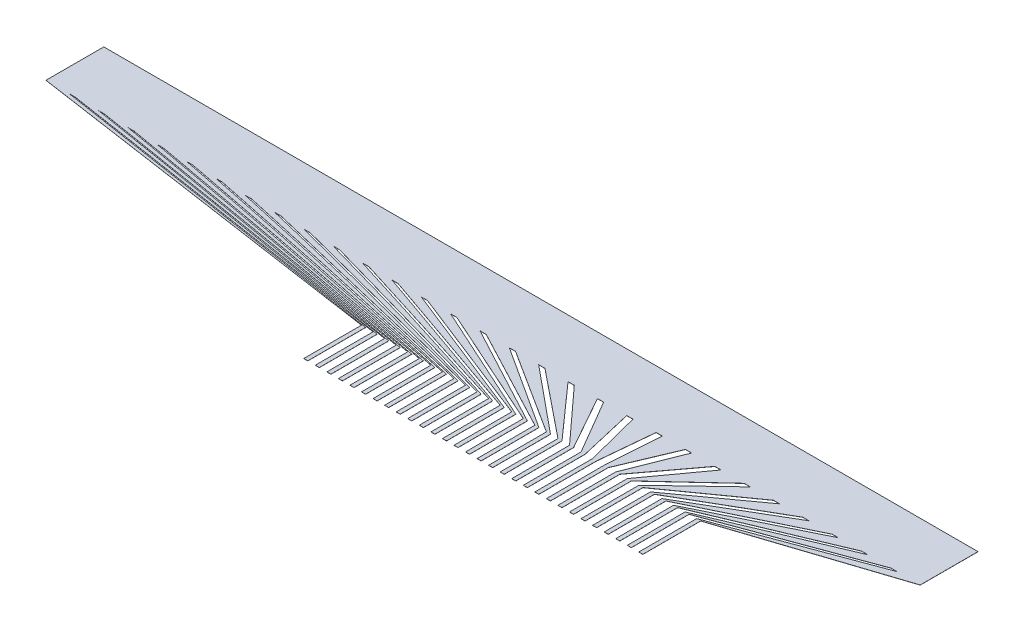
from build123d import *

# Parameters (mm, degrees)
EXTRUDE_1_DEPTH     = 0.01
EXTRUDE_1_2_DEPTH   = 0.01
EXTRUDE_1_3_DEPTH   = 0.01
EXTRUDE_1_4_DEPTH   = 0.01
EXTRUDE_1_5_DEPTH   = 0.01
EXTRUDE_1_6_DEPTH   = 0.01
EXTRUDE_1_7_DEPTH   = 0.01
EXTRUDE_1_8_DEPTH   = 0.01
EXTRUDE_1_9_DEPTH   = 0.01
EXTRUDE_1_10_DEPTH  = 0.01
EXTRUDE_1_11_DEPTH  = 0.01
EXTRUDE_1_12_DEPTH  = 0.01
EXTRUDE_1_13_DEPTH  = 0.01
EXTRUDE_1_14_DEPTH  = 0.01
EXTRUDE_1_15_DEPTH  = 0.01
EXTRUDE_1_16_DEPTH  = 0.01
EXTRUDE_1_17_DEPTH  = 0.01
EXTRUDE_1_18_DEPTH  = 0.01
EXTRUDE_1_19_DEPTH  = 0.01
EXTRUDE_1_20_DEPTH  = 0.01
EXTRUDE_1_21_DEPTH  = 0.01
EXTRUDE_1_22_DEPTH  = 0.01
EXTRUDE_1_23_DEPTH  = 0.01
EXTRUDE_1_24_DEPTH  = 0.01
EXTRUDE_1_25_DEPTH  = 0.01
EXTRUDE_1_26_DEPTH  = 0.01
EXTRUDE_1_27_DEPTH  = 0.01
EXTRUDE_1_28_DEPTH  = 0.01
EXTRUDE_1_29_DEPTH  = 0.01
EXTRUDE_1_30_DEPTH  = 0.01
SKETCH_2_W          = 75.66
SKETCH_2_H          = 5
EXTRUDE_2_DEPTH     = 0.01
SKETCH_3_W          = 29.347621289
SKETCH_3_H          = 1
CUT_EXTRUDE_1_DEPTH = 0.01


with BuildPart() as part:
    # 草图1 → 凸台-拉伸1 (new body)
    with BuildSketch(Plane(origin=(0, 0, 0), x_dir=(1, 0, 0), z_dir=(0, 1, 0))):
        Polygon((76.2, 0), (76.2, -5), (61.89758937, -9.7), (61.89758937, -15.7), (61.549968081, -15.7), (61.549968081, -9.7), (74.2, -5), (74.2, 0), align=None)
    extrude(amount=EXTRUDE_1_DEPTH)



with BuildPart() as body_2:
    # 草图1 → Extrude 1 2 (new body)
    with BuildSketch(Plane(origin=(0, 0, 0), x_dir=(1, 0, 0), z_dir=(0, 1, 0))):
        Polygon((71.66, 0), (73.66, 0), (73.66, -5), (60.89758937, -9.7), (60.89758937, -15.7), (60.549968081, -15.7), (60.549968081, -9.7), (71.66, -5), align=None)
    extrude(amount=EXTRUDE_1_2_DEPTH)


with BuildPart() as body_3:
    # 草图1 → Extrude 1 3 (new body)
    with BuildSketch(Plane(origin=(0, 0, 0), x_dir=(1, 0, 0), z_dir=(0, 1, 0))):
        Polygon((69.12, 0), (71.12, 0), (71.12, -5), (59.89758937, -9.7), (59.89758937, -15.7), (59.549968081, -15.7), (59.549968081, -9.7), (69.12, -5), align=None)
    extrude(amount=EXTRUDE_1_3_DEPTH)


with BuildPart() as body_4:
    # 草图1 → Extrude 1 4 (new body)
    with BuildSketch(Plane(origin=(0, 0, 0), x_dir=(1, 0, 0), z_dir=(0, 1, 0))):
        Polygon((66.58, 0), (68.58, 0), (68.58, -5), (58.89758937, -9.7), (58.89758937, -15.7), (58.549968081, -15.7), (58.549968081, -9.7), (66.58, -5), align=None)
    extrude(amount=EXTRUDE_1_4_DEPTH)


with BuildPart() as body_5:
    # 草图1 → Extrude 1 5 (new body)
    with BuildSketch(Plane(origin=(0, 0, 0), x_dir=(1, 0, 0), z_dir=(0, 1, 0))):
        Polygon((64.04, 0), (66.04, 0), (66.04, -5), (57.89758937, -9.7), (57.89758937, -15.7), (57.549968081, -15.7), (57.549968081, -9.7), (64.04, -5), align=None)
    extrude(amount=EXTRUDE_1_5_DEPTH)


with BuildPart() as body_6:
    # 草图1 → Extrude 1 6 (new body)
    with BuildSketch(Plane(origin=(0, 0, 0), x_dir=(1, 0, 0), z_dir=(0, 1, 0))):
        Polygon((61.5, 0), (63.5, 0), (63.5, -5), (56.89758937, -9.7), (56.89758937, -15.7), (56.549968081, -15.7), (56.549968081, -9.7), (61.5, -5), align=None)
    extrude(amount=EXTRUDE_1_6_DEPTH)


with BuildPart() as body_7:
    # 草图1 → Extrude 1 7 (new body)
    with BuildSketch(Plane(origin=(0, 0, 0), x_dir=(1, 0, 0), z_dir=(0, 1, 0))):
        Polygon((58.96, 0), (60.96, 0), (60.96, -5), (55.89758937, -9.7), (55.89758937, -15.7), (55.549968081, -15.7), (55.549968081, -9.7), (58.96, -5), align=None)
    extrude(amount=EXTRUDE_1_7_DEPTH)


with BuildPart() as body_8:
    # 草图1 → Extrude 1 8 (new body)
    with BuildSketch(Plane(origin=(0, 0, 0), x_dir=(1, 0, 0), z_dir=(0, 1, 0))):
        Polygon((56.42, 0), (58.42, 0), (58.42, -5), (54.89758937, -9.7), (54.89758937, -15.7), (54.549968081, -15.7), (54.549968081, -9.7), (56.42, -5), align=None)
    extrude(amount=EXTRUDE_1_8_DEPTH)


with BuildPart() as body_9:
    # 草图1 → Extrude 1 9 (new body)
    with BuildSketch(Plane(origin=(0, 0, 0), x_dir=(1, 0, 0), z_dir=(0, 1, 0))):
        Polygon((53.88, 0), (55.88, 0), (55.88, -5), (53.89758937, -9.7), (53.89758937, -15.7), (53.549968081, -15.7), (53.549968081, -9.7), (53.88, -5), align=None)
    extrude(amount=EXTRUDE_1_9_DEPTH)


with BuildPart() as body_10:
    # 草图1 → Extrude 1 10 (new body)
    with BuildSketch(Plane(origin=(0, 0, 0), x_dir=(1, 0, 0), z_dir=(0, 1, 0))):
        Polygon((51.34, 0), (53.34, 0), (53.34, -5), (52.89758937, -9.7), (52.89758937, -15.7), (52.549968081, -15.7), (52.549968081, -9.7), (51.34, -5), align=None)
    extrude(amount=EXTRUDE_1_10_DEPTH)


with BuildPart() as body_11:
    # 草图1 → Extrude 1 11 (new body)
    with BuildSketch(Plane(origin=(0, 0, 0), x_dir=(1, 0, 0), z_dir=(0, 1, 0))):
        Polygon((48.8, 0), (50.8, 0), (50.8, -5), (51.89758937, -9.7), (51.89758937, -15.7), (51.549968081, -15.7), (51.549968081, -9.7), (48.8, -5), align=None)
    extrude(amount=EXTRUDE_1_11_DEPTH)


with BuildPart() as body_12:
    # 草图1 → Extrude 1 12 (new body)
    with BuildSketch(Plane(origin=(0, 0, 0), x_dir=(1, 0, 0), z_dir=(0, 1, 0))):
        Polygon((46.26, 0), (48.26, 0), (48.26, -5), (50.89758937, -9.7), (50.89758937, -15.7), (50.549968081, -15.7), (50.549968081, -9.7), (46.26, -5), align=None)
    extrude(amount=EXTRUDE_1_12_DEPTH)


with BuildPart() as body_13:
    # 草图1 → Extrude 1 13 (new body)
    with BuildSketch(Plane(origin=(0, 0, 0), x_dir=(1, 0, 0), z_dir=(0, 1, 0))):
        Polygon((43.72, 0), (45.72, 0), (45.72, -5), (49.89758937, -9.7), (49.89758937, -15.7), (49.549968081, -15.7), (49.549968081, -9.7), (43.72, -5), align=None)
    extrude(amount=EXTRUDE_1_13_DEPTH)


with BuildPart() as body_14:
    # 草图1 → Extrude 1 14 (new body)
    with BuildSketch(Plane(origin=(0, 0, 0), x_dir=(1, 0, 0), z_dir=(0, 1, 0))):
        Polygon((41.18, 0), (43.18, 0), (43.18, -5), (48.89758937, -9.7), (48.89758937, -15.7), (48.549968081, -15.7), (48.549968081, -9.7), (41.18, -5), align=None)
    extrude(amount=EXTRUDE_1_14_DEPTH)


with BuildPart() as body_15:
    # 草图1 → Extrude 1 15 (new body)
    with BuildSketch(Plane(origin=(0, 0, 0), x_dir=(1, 0, 0), z_dir=(0, 1, 0))):
        Polygon((38.64, 0), (40.64, 0), (40.64, -5), (47.89758937, -9.7), (47.89758937, -15.7), (47.549968081, -15.7), (47.549968081, -9.7), (38.64, -5), align=None)
    extrude(amount=EXTRUDE_1_15_DEPTH)


with BuildPart() as body_16:
    # 草图1 → Extrude 1 16 (new body)
    with BuildSketch(Plane(origin=(0, 0, 0), x_dir=(1, 0, 0), z_dir=(0, 1, 0))):
        Polygon((36.1, 0), (38.1, 0), (38.1, -5), (46.89758937, -9.7), (46.89758937, -15.7), (46.549968081, -15.7), (46.549968081, -9.7), (36.1, -5), align=None)
    extrude(amount=EXTRUDE_1_16_DEPTH)


with BuildPart() as body_17:
    # 草图1 → Extrude 1 17 (new body)
    with BuildSketch(Plane(origin=(0, 0, 0), x_dir=(1, 0, 0), z_dir=(0, 1, 0))):
        Polygon((33.56, 0), (35.56, 0), (35.56, -5), (45.89758937, -9.7), (45.89758937, -15.7), (45.549968081, -15.7), (45.549968081, -9.7), (33.56, -5), align=None)
    extrude(amount=EXTRUDE_1_17_DEPTH)


with BuildPart() as body_18:
    # 草图1 → Extrude 1 18 (new body)
    with BuildSketch(Plane(origin=(0, 0, 0), x_dir=(1, 0, 0), z_dir=(0, 1, 0))):
        Polygon((31.02, 0), (33.02, 0), (33.02, -5), (44.89758937, -9.7), (44.89758937, -15.7), (44.549968081, -15.7), (44.549968081, -9.7), (31.02, -5), align=None)
    extrude(amount=EXTRUDE_1_18_DEPTH)


with BuildPart() as body_19:
    # 草图1 → Extrude 1 19 (new body)
    with BuildSketch(Plane(origin=(0, 0, 0), x_dir=(1, 0, 0), z_dir=(0, 1, 0))):
        Polygon((28.48, 0), (30.48, 0), (30.48, -5), (43.89758937, -9.7), (43.89758937, -15.7), (43.549968081, -15.7), (43.549968081, -9.7), (28.48, -5), align=None)
    extrude(amount=EXTRUDE_1_19_DEPTH)


with BuildPart() as body_20:
    # 草图1 → Extrude 1 20 (new body)
    with BuildSketch(Plane(origin=(0, 0, 0), x_dir=(1, 0, 0), z_dir=(0, 1, 0))):
        Polygon((25.94, 0), (27.94, 0), (27.94, -5), (42.89758937, -9.7), (42.89758937, -15.7), (42.549968081, -15.7), (42.549968081, -9.7), (25.94, -5), align=None)
    extrude(amount=EXTRUDE_1_20_DEPTH)


with BuildPart() as body_21:
    # 草图1 → Extrude 1 21 (new body)
    with BuildSketch(Plane(origin=(0, 0, 0), x_dir=(1, 0, 0), z_dir=(0, 1, 0))):
        Polygon((23.4, 0), (25.4, 0), (25.4, -5), (41.89758937, -9.7), (41.89758937, -15.7), (41.549968081, -15.7), (41.549968081, -9.7), (23.4, -5), align=None)
    extrude(amount=EXTRUDE_1_21_DEPTH)


with BuildPart() as body_22:
    # 草图1 → Extrude 1 22 (new body)
    with BuildSketch(Plane(origin=(0, 0, 0), x_dir=(1, 0, 0), z_dir=(0, 1, 0))):
        Polygon((20.86, 0), (22.86, 0), (22.86, -5), (40.89758937, -9.7), (40.89758937, -15.7), (40.549968081, -15.7), (40.549968081, -9.7), (20.86, -5), align=None)
    extrude(amount=EXTRUDE_1_22_DEPTH)


with BuildPart() as body_23:
    # 草图1 → Extrude 1 23 (new body)
    with BuildSketch(Plane(origin=(0, 0, 0), x_dir=(1, 0, 0), z_dir=(0, 1, 0))):
        Polygon((18.32, 0), (20.32, 0), (20.32, -5), (39.89758937, -9.7), (39.89758937, -15.7), (39.549968081, -15.7), (39.549968081, -9.7), (18.32, -5), align=None)
    extrude(amount=EXTRUDE_1_23_DEPTH)


with BuildPart() as body_24:
    # 草图1 → Extrude 1 24 (new body)
    with BuildSketch(Plane(origin=(0, 0, 0), x_dir=(1, 0, 0), z_dir=(0, 1, 0))):
        Polygon((15.78, 0), (17.78, 0), (17.78, -5), (38.89758937, -9.7), (38.89758937, -15.7), (38.549968081, -15.7), (38.549968081, -9.7), (15.78, -5), align=None)
    extrude(amount=EXTRUDE_1_24_DEPTH)


with BuildPart() as body_25:
    # 草图1 → Extrude 1 25 (new body)
    with BuildSketch(Plane(origin=(0, 0, 0), x_dir=(1, 0, 0), z_dir=(0, 1, 0))):
        Polygon((13.24, 0), (15.24, 0), (15.24, -5), (37.89758937, -9.7), (37.89758937, -15.7), (37.549968081, -15.7), (37.549968081, -9.7), (13.24, -5), align=None)
    extrude(amount=EXTRUDE_1_25_DEPTH)


with BuildPart() as body_26:
    # 草图1 → Extrude 1 26 (new body)
    with BuildSketch(Plane(origin=(0, 0, 0), x_dir=(1, 0, 0), z_dir=(0, 1, 0))):
        Polygon((10.7, 0), (12.7, 0), (12.7, -5), (36.89758937, -9.7), (36.89758937, -15.7), (36.549968081, -15.7), (36.549968081, -9.7), (10.7, -5), align=None)
    extrude(amount=EXTRUDE_1_26_DEPTH)


with BuildPart() as body_27:
    # 草图1 → Extrude 1 27 (new body)
    with BuildSketch(Plane(origin=(0, 0, 0), x_dir=(1, 0, 0), z_dir=(0, 1, 0))):
        Polygon((8.16, 0), (10.16, 0), (10.16, -5), (35.89758937, -9.7), (35.89758937, -15.7), (35.549968081, -15.7), (35.549968081, -9.7), (8.16, -5), align=None)
    extrude(amount=EXTRUDE_1_27_DEPTH)


with BuildPart() as body_28:
    # 草图1 → Extrude 1 28 (new body)
    with BuildSketch(Plane(origin=(0, 0, 0), x_dir=(1, 0, 0), z_dir=(0, 1, 0))):
        Polygon((5.62, 0), (7.62, 0), (7.62, -5), (34.89758937, -9.7), (34.89758937, -15.7), (34.549968081, -15.7), (34.549968081, -9.7), (5.62, -5), align=None)
    extrude(amount=EXTRUDE_1_28_DEPTH)


with BuildPart() as body_29:
    # 草图1 → Extrude 1 29 (new body)
    with BuildSketch(Plane(origin=(0, 0, 0), x_dir=(1, 0, 0), z_dir=(0, 1, 0))):
        Polygon((3.08, 0), (5.08, 0), (5.08, -5), (33.89758937, -9.7), (33.89758937, -15.7), (33.549968081, -15.7), (33.549968081, -9.7), (3.08, -5), align=None)
    extrude(amount=EXTRUDE_1_29_DEPTH)


with BuildPart() as body_30:
    # 草图1 → Extrude 1 30 (new body)
    with BuildSketch(Plane(origin=(0, 0, 0), x_dir=(1, 0, 0), z_dir=(0, 1, 0))):
        Polygon((0.54, 0), (2.54, 0), (2.54, -5), (32.89758937, -9.7), (32.89758937, -15.7), (32.549968081, -15.7), (32.549968081, -9.7), (0.54, -5), align=None)
    extrude(amount=EXTRUDE_1_30_DEPTH)


with BuildPart() as part_1:
    add(part.part)

    add(body_2.part)  # 凸台-拉伸2 merges body 2

    add(body_3.part)  # 凸台-拉伸2 merges body 3

    add(body_4.part)  # 凸台-拉伸2 merges body 4

    add(body_5.part)  # 凸台-拉伸2 merges body 5

    add(body_6.part)  # 凸台-拉伸2 merges body 6

    add(body_7.part)  # 凸台-拉伸2 merges body 7

    add(body_8.part)  # 凸台-拉伸2 merges body 8

    add(body_9.part)  # 凸台-拉伸2 merges body 9

    add(body_10.part)  # 凸台-拉伸2 merges body 10

    add(body_11.part)  # 凸台-拉伸2 merges body 11

    add(body_12.part)  # 凸台-拉伸2 merges body 12

    add(body_13.part)  # 凸台-拉伸2 merges body 13

    add(body_14.part)  # 凸台-拉伸2 merges body 14

    add(body_15.part)  # 凸台-拉伸2 merges body 15

    add(body_16.part)  # 凸台-拉伸2 merges body 16

    add(body_17.part)  # 凸台-拉伸2 merges body 17

    add(body_18.part)  # 凸台-拉伸2 merges body 18

    add(body_19.part)  # 凸台-拉伸2 merges body 19

    add(body_20.part)  # 凸台-拉伸2 merges body 20

    add(body_21.part)  # 凸台-拉伸2 merges body 21

    add(body_22.part)  # 凸台-拉伸2 merges body 22

    add(body_23.part)  # 凸台-拉伸2 merges body 23

    add(body_24.part)  # 凸台-拉伸2 merges body 24

    add(body_25.part)  # 凸台-拉伸2 merges body 25

    add(body_26.part)  # 凸台-拉伸2 merges body 26

    add(body_27.part)  # 凸台-拉伸2 merges body 27

    add(body_28.part)  # 凸台-拉伸2 merges body 28

    add(body_29.part)  # 凸台-拉伸2 merges body 29

    add(body_30.part)  # 凸台-拉伸2 merges body 30
    # 草图2 → 凸台-拉伸2 (add)
    with BuildSketch(Plane(origin=(0, 0.01, 0), x_dir=(1, 0, 0), z_dir=(0, 1, 0))):
        with Locations((38.37, -2.5)):
            Rectangle(SKETCH_2_W, SKETCH_2_H)
    extrude(amount=-EXTRUDE_2_DEPTH)

    # 草图3 → 切除-拉伸1 (cut)
    with BuildSketch(Plane(origin=(0, 0.01, 0), x_dir=(1, 0, 0), z_dir=(0, 1, 0))):
        with Locations((47.223778726, -15.2)):
            Rectangle(SKETCH_3_W, SKETCH_3_H)
    extrude(amount=-CUT_EXTRUDE_1_DEPTH, mode=Mode.SUBTRACT)


solid = part_1.part
